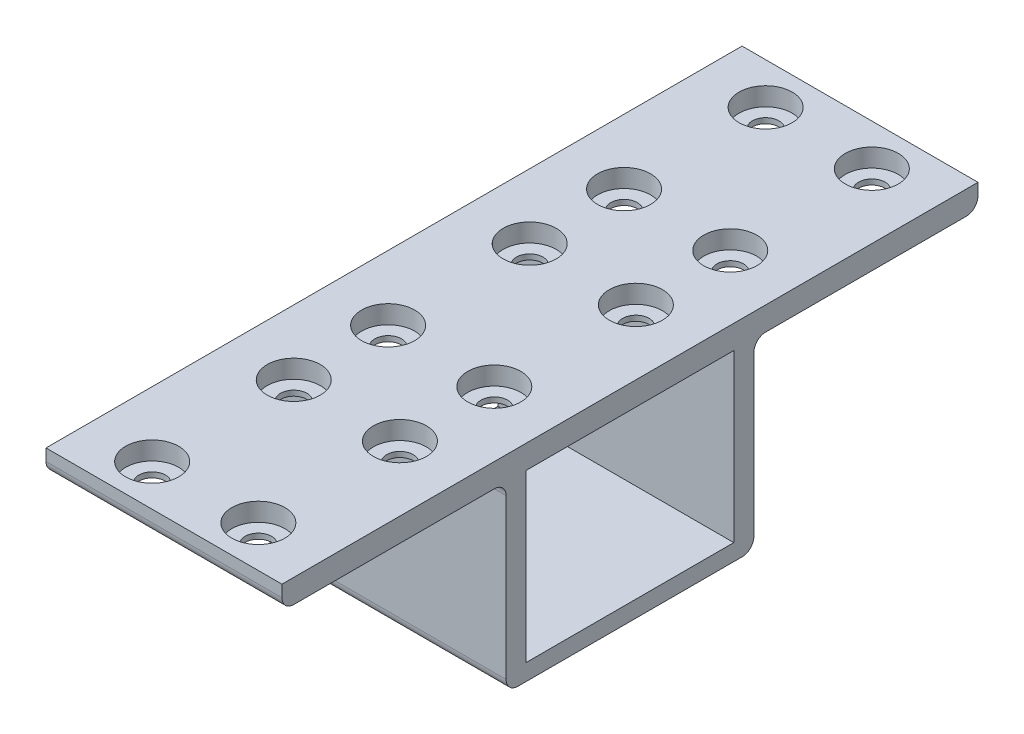
from build123d import *

# Parameters (mm, degrees)
SKETCH1_W                                        = 35.2
SKETCH1_H                                        = 28.2
BOSS_EXTRUDE1_DEPTH                              = 40
FILLET1_R                                        = 2
CBORE_FOR_M4_PAN_HEAD_MACHINE_SCREW1_D           = 4.5
CBORE_FOR_M4_PAN_HEAD_MACHINE_SCREW1_DEPTH       = 4
CBORE_FOR_M4_PAN_HEAD_MACHINE_SCREW1_CBORE_D     = 9
CBORE_FOR_M4_PAN_HEAD_MACHINE_SCREW1_CBORE_DEPTH = 3.1
SKETCH5_W                                        = 8
SKETCH5_H                                        = 4.7
SKETCH5_R                                        = 1.35
BOSS_EXTRUDE2_DEPTH                              = 3
SKETCH6_W                                        = 8
SKETCH6_H                                        = 4.7
SKETCH6_R                                        = 1.35
BOSS_EXTRUDE3_DEPTH                              = 6
BOSS_EXTRUDE4_REACH                              = 129.609
SKETCH7_W                                        = 0.8
SKETCH7_H                                        = 2.4
SKETCH8_W                                        = 0.8
SKETCH8_H                                        = 2.4
BOSS_EXTRUDE5_DEPTH                              = 2


with BuildPart() as part:
    # Sketch1 → Boss-Extrude1 (new body)
    with BuildSketch(Plane(origin=(0, 0, 0), x_dir=(0, 0, -1), z_dir=(1, 0, 0))):
        Polygon((0, 0), (118, 0), (118, -4), (80, -4), (80, -35), (38, -35), (38, -4), (0, -4), align=None)
        with Locations((59, -18.1)):
            Rectangle(SKETCH1_W, SKETCH1_H, mode=Mode.SUBTRACT)
    extrude(amount=-BOSS_EXTRUDE1_DEPTH)

    # Fillet1
    fillet1_edges = [part.edges().sort_by_distance(p)[0] for p in [
        (-20, -4, -118),
        (-20, -4, -80),
        (-20, -35, -80),
        (-20, -35, -38),
        (-20, -4, -38),
        (-20, -4, 0),
    ]]
    fillet(fillet1_edges, radius=FILLET1_R)

    # CBORE for M4 Pan Head Machine Screw1
    with Locations(Plane(origin=(-11, 0, -111), x_dir=(0, 0, 1), z_dir=(0, 1, 0))):
        with Locations((0, 0), (0, -18), (24, 0), (24, -18), (40, 0), (64, 0), (64, -18), (40, -18), (80, 0), (80, -18), (104, -18), (104, 0)):
            CounterBoreHole(CBORE_FOR_M4_PAN_HEAD_MACHINE_SCREW1_D / 2, CBORE_FOR_M4_PAN_HEAD_MACHINE_SCREW1_CBORE_D / 2, CBORE_FOR_M4_PAN_HEAD_MACHINE_SCREW1_CBORE_DEPTH, depth=CBORE_FOR_M4_PAN_HEAD_MACHINE_SCREW1_DEPTH)

    # Sketch5 → Boss-Extrude2 (add)
    with BuildSketch(Plane(origin=(-39, 0, 0), x_dir=(0, 0, -1), z_dir=(1, 0, 0))):
        with Locations((59, -37.35)):
            Rectangle(SKETCH5_W, SKETCH5_H)
        with Locations((59, -38)):
            Circle(SKETCH5_R, mode=Mode.SUBTRACT)
    extrude(amount=BOSS_EXTRUDE2_DEPTH)

    # Sketch6 → Boss-Extrude3 (add)
    with BuildSketch(Plane(origin=(-28, 0, 0), x_dir=(0, 0, -1), z_dir=(1, 0, 0))):
        with Locations((59, -37.35)):
            Rectangle(SKETCH6_W, SKETCH6_H)
        with Locations((59, -38)):
            Circle(SKETCH6_R, mode=Mode.SUBTRACT)
    extrude(amount=BOSS_EXTRUDE3_DEPTH)

    # Sketch7 → Boss-Extrude4 (add, up to next)
    with BuildSketch(Plane.ZY.offset(28), mode=Mode.PRIVATE) as boss_extrude4_sk1:
        with Locations((-62.6, -38.2)):
            Rectangle(SKETCH7_W, SKETCH7_H)
    boss_extrude4_tool1 = extrude(boss_extrude4_sk1.sketch, amount=BOSS_EXTRUDE4_REACH, mode=Mode.PRIVATE) - part.part
    # Sketch7 → Boss-Extrude4 (add, up to next)
    with BuildSketch(Plane.ZY.offset(28), mode=Mode.PRIVATE) as boss_extrude4_sk2:
        with Locations((-55.4, -38.2)):
            Rectangle(SKETCH7_W, SKETCH7_H)
    boss_extrude4_tool2 = extrude(boss_extrude4_sk2.sketch, amount=BOSS_EXTRUDE4_REACH, mode=Mode.PRIVATE) - part.part
    add(boss_extrude4_tool1.solids().sort_by_distance((-28, -38.2, -62.6))[0])
    add(boss_extrude4_tool2.solids().sort_by_distance((-28, -38.2, -55.4))[0])

    # Sketch8 → Boss-Extrude5 (add)
    with BuildSketch(Plane(origin=(-36, 0, 0), x_dir=(0, 0, -1), z_dir=(1, 0, 0))):
        with Locations((62.6, -38.2)):
            Rectangle(SKETCH8_W, SKETCH8_H)
        with Locations((55.4, -38.2)):
            Rectangle(SKETCH8_W, SKETCH8_H)
    extrude(amount=BOSS_EXTRUDE5_DEPTH)


solid = part.part
